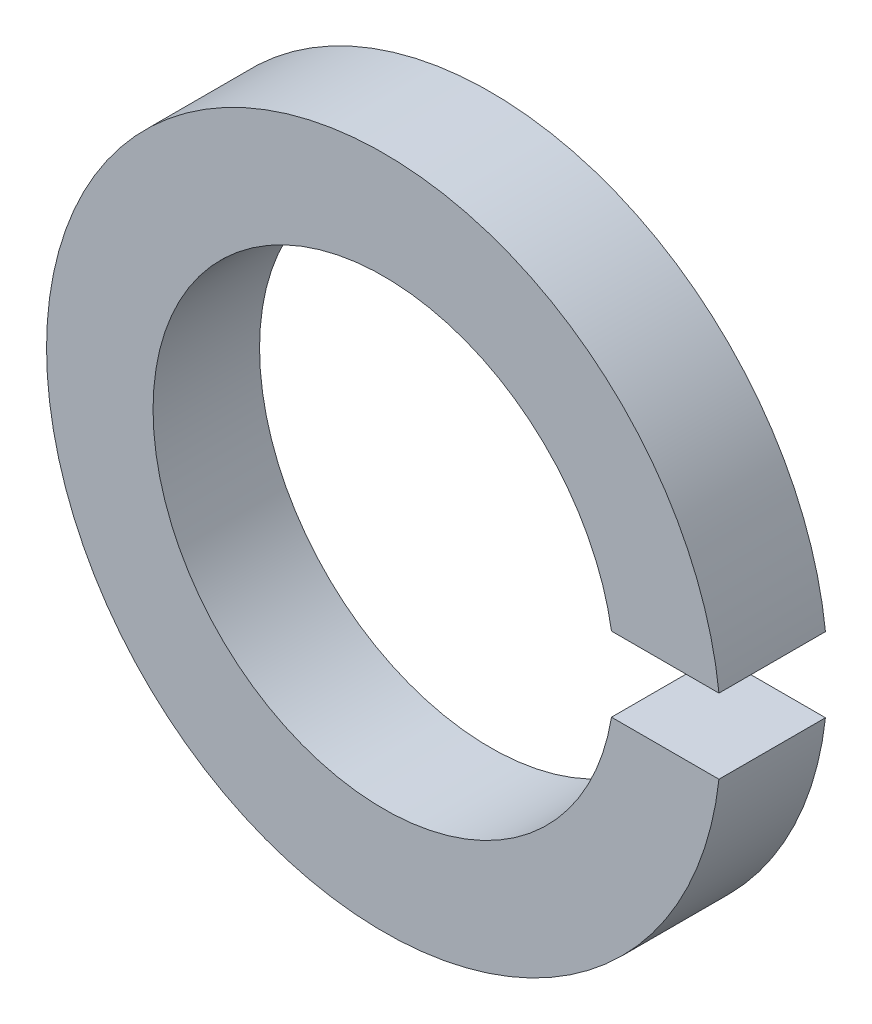
from build123d import *

# Parameters (mm, degrees)
SKETCH_1_R          = 1.9
SKETCH_1_R_2        = 1.3
EXTRUDE_1_DEPTH     = 0.6
SKETCH_2_W          = 2.246639396
SKETCH_2_H          = 0.42
CUT_EXTRUDE_1_DEPTH = 3.75317998


with BuildPart() as part:
    # Эскиз1 → Вытянуть1 (new body)
    with BuildSketch(Plane.XY):
        Circle(SKETCH_1_R)
        Circle(SKETCH_1_R_2, mode=Mode.SUBTRACT)
    extrude(amount=EXTRUDE_1_DEPTH)

    # Эскиз2 → Вырез-Вытянуть1 (cut, through all)
    with BuildSketch(Plane.XY.offset(0.6)):
        with Locations((2.195083291, 0)):
            Rectangle(SKETCH_2_W, SKETCH_2_H)
    extrude(amount=-CUT_EXTRUDE_1_DEPTH, mode=Mode.SUBTRACT)


solid = part.part
